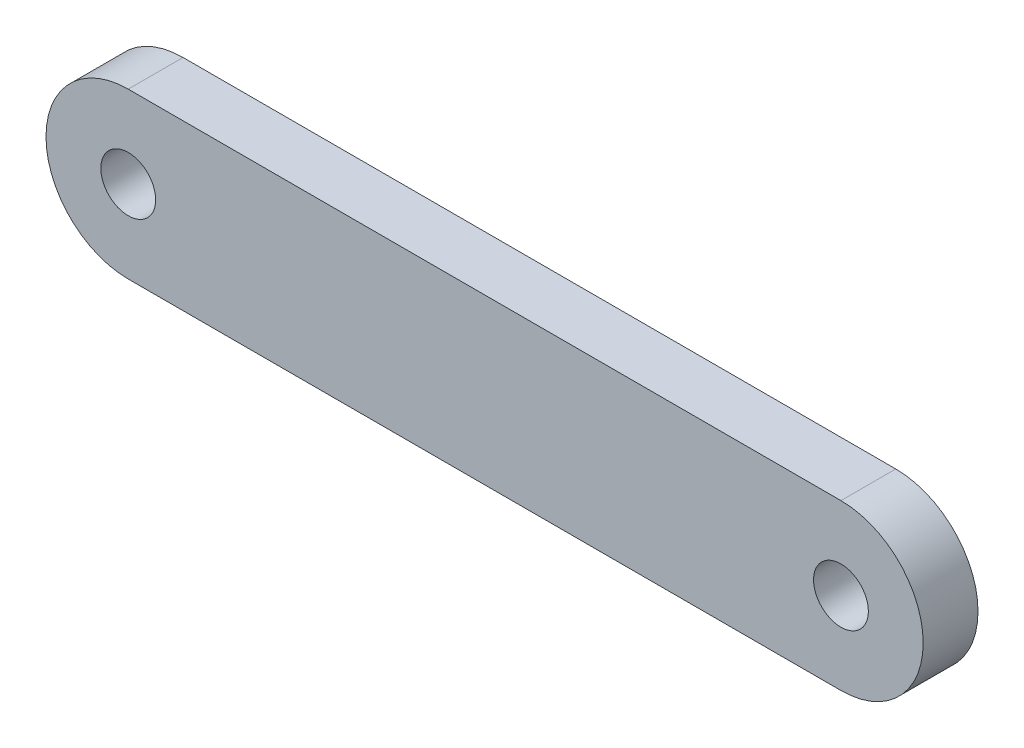
from build123d import *

# Parameters (mm, degrees)
SKETCH1_R           = 5
BOSS_EXTRUDE1_DEPTH = 10


with BuildPart() as part:
    # Sketch1 → Boss-Extrude1 (new body)
    with BuildSketch(Plane.XY):
        with BuildLine():
            Line((-65, 15), (65, 15))
            ThreePointArc((65, 15), (80, 0), (65, -15))
            Line((65, -15), (-65, -15))
            ThreePointArc((-65, -15), (-80, 0), (-65, 15))
        make_face()
        with Locations((-65, 0)):
            Circle(SKETCH1_R, mode=Mode.SUBTRACT)
        with Locations((65, 0)):
            Circle(SKETCH1_R, mode=Mode.SUBTRACT)
    extrude(amount=BOSS_EXTRUDE1_DEPTH)


solid = part.part
